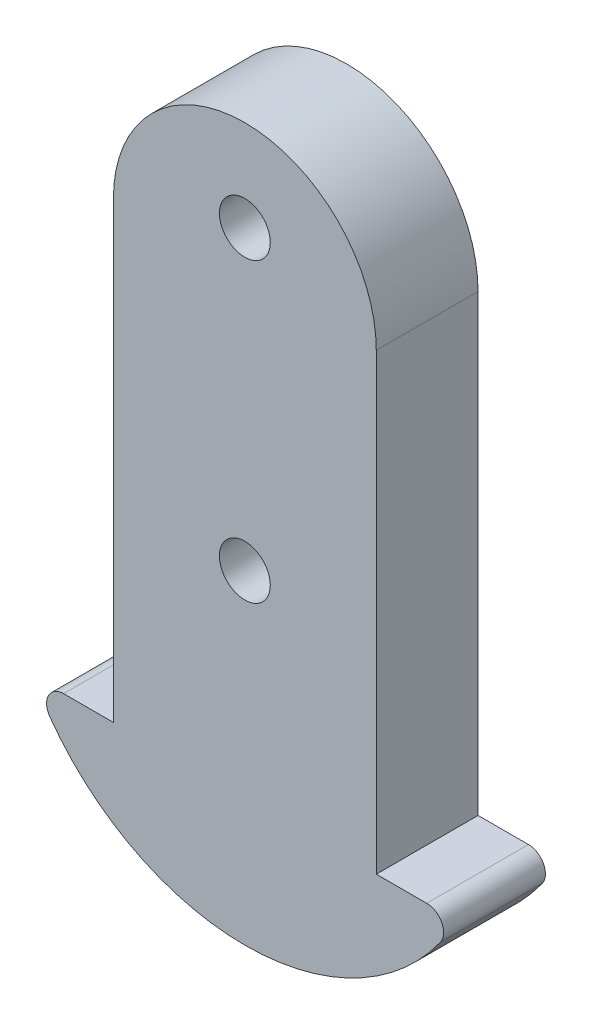
from build123d import *

# Parameters (mm, degrees)
SKETCH1_R           = 1.5
BOSS_EXTRUDE2_DEPTH = 6


with BuildPart() as part:
    # Sketch1 → Boss-Extrude2 (new body)
    # profile 1 of 2: a face of its own
    with BuildSketch(Plane.XY):
        with BuildLine():
            Line((-7.766144764, 8.750016816), (-7.766144764, -18))
            Line((-7.766144764, -18), (7.733855236, -18))
            Line((7.733855236, -18), (7.733855236, 8.750016816))
            ThreePointArc((7.733855236, 8.750016816), (7.327886817, 11.225436), (6.152513266, 13.44151531))
            ThreePointArc((6.152513266, 13.44151531), (-2.491563947, 16.094048398), (-7.766144764, 8.750016816))
        make_face()
        with Locations((-0.016144764, -6.375)):
            Circle(SKETCH1_R, mode=Mode.SUBTRACT)
        with Locations((-0.016144764, 11.125)):
            Circle(SKETCH1_R, mode=Mode.SUBTRACT)
    # profile 2 of 2: a face of its own
    with BuildSketch(Plane.XY):
        with BuildLine():
            ThreePointArc((10.704360482, -18), (11.593820566, -18.542987134), (11.517349886, -19.582278481))
            ThreePointArc((11.517349886, -19.582278481), (0, -25.5), (-11.517349886, -19.582278481))
            ThreePointArc((-11.517349886, -19.582278481), (-11.593820566, -18.542987134), (-10.704360482, -18))
            Line((-10.704360482, -18), (10.704360482, -18))
        make_face()
    extrude(amount=BOSS_EXTRUDE2_DEPTH)


solid = part.part
